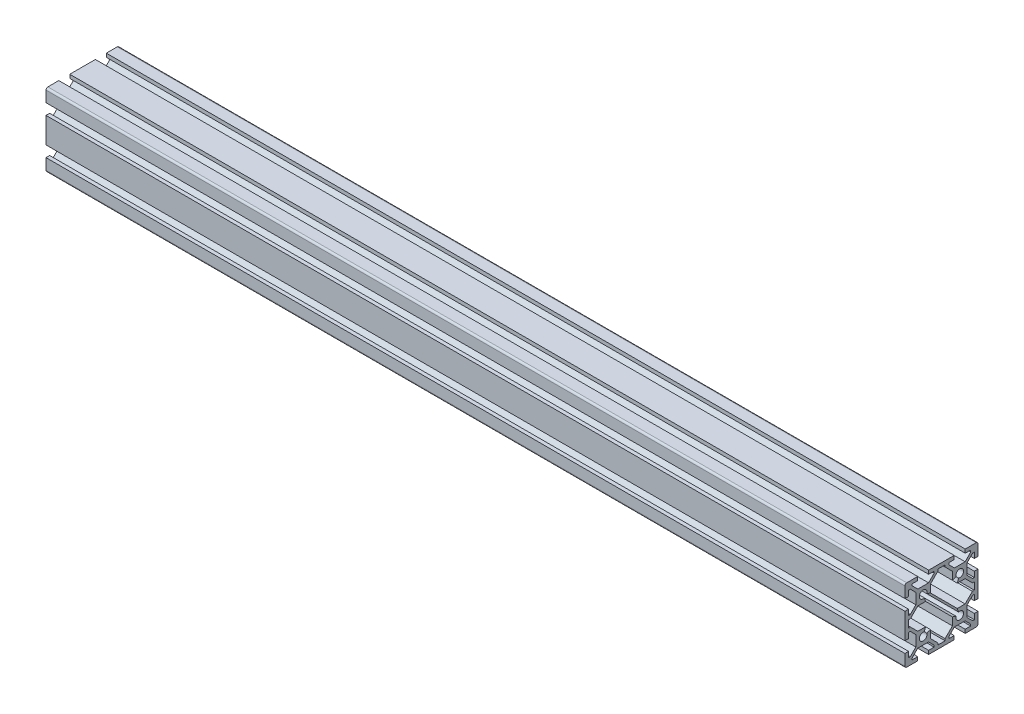
from build123d import *

# Parameters (mm, degrees)
BOSS_EXTRUDE1_DEPTH = 470
SKETCH10_R          = 2.1
BOSS_EXTRUDE4_DEPTH = 15
BOSS_EXTRUDE5_START = -15
SKETCH11_R          = 2.1
BOSS_EXTRUDE5_DEPTH = 15
TAPPED_HOLE3_D      = 4.2
TAPPED_HOLE3_DEPTH  = 15
TAPPED_HOLE4_D      = 4.2


with BuildPart() as part:
    # Sketch1 → Boss-Extrude1 (new body)
    with BuildSketch(Plane(origin=(0, 0, 0), x_dir=(0, 0, -1), z_dir=(1, 0, 0))):
        with BuildLine():
            Line((-20, 19), (-20, 13))
            Line((-20, 13), (-18, 13))
            Line((-18, 13), (-18, 16))
            Line((-18, 16), (-17.060660172, 16))
            Line((-17.060660172, 16), (-14, 12.939339828))
            Line((-14, 12.939339828), (-14, 7.060660172))
            Line((-14, 7.060660172), (-17.060660172, 4))
            Line((-17.060660172, 4), (-18, 4))
            Line((-18, 4), (-18, 7))
            Line((-18, 7), (-20, 7))
            Line((-20, 7), (-20, -7))
            Line((-20, -7), (-18, -7))
            Line((-18, -7), (-18, -4))
            Line((-18, -4), (-17.060660172, -4))
            Line((-17.060660172, -4), (-14, -7.060660172))
            Line((-14, -7.060660172), (-14, -12.939339828))
            Line((-14, -12.939339828), (-17.060660172, -16))
            Line((-17.060660172, -16), (-18, -16))
            Line((-18, -16), (-18, -13))
            Line((-18, -13), (-20, -13))
            Line((-20, -13), (-20, -19))
            ThreePointArc((-20, -19), (-19.707106781, -19.707106781), (-19, -20))
            Line((-19, -20), (-13, -20))
            Line((-13, -20), (-13, -18))
            Line((-13, -18), (-16, -18))
            Line((-16, -18), (-16, -17.060660172))
            Line((-16, -17.060660172), (-12.939339828, -14))
            Line((-12.939339828, -14), (-7.060660172, -14))
            Line((-7.060660172, -14), (-4, -17.060660172))
            Line((-4, -17.060660172), (-4, -18))
            Line((-4, -18), (-7, -18))
            Line((-7, -18), (-7, -20))
            Line((-7, -20), (7, -20))
            Line((7, -20), (7, -18))
            Line((7, -18), (4, -18))
            Line((4, -18), (4, -17.060660172))
            Line((4, -17.060660172), (7.060660172, -14))
            Line((7.060660172, -14), (12.939339828, -14))
            Line((12.939339828, -14), (16, -17.060660172))
            Line((16, -17.060660172), (16, -18))
            Line((16, -18), (13, -18))
            Line((13, -18), (13, -20))
            Line((13, -20), (19, -20))
            ThreePointArc((19, -20), (19.707106781, -19.707106781), (20, -19))
            Line((20, -19), (20, -13))
            Line((20, -13), (18, -13))
            Line((18, -13), (18, -16))
            Line((18, -16), (17.060660172, -16))
            Line((17.060660172, -16), (14, -12.939339828))
            Line((14, -12.939339828), (14, -7.060660172))
            Line((14, -7.060660172), (17.060660172, -4))
            Line((17.060660172, -4), (18, -4))
            Line((18, -4), (18, -7))
            Line((18, -7), (20, -7))
            Line((20, -7), (20, 7))
            Line((20, 7), (18, 7))
            Line((18, 7), (18, 4))
            Line((18, 4), (17.060660172, 4))
            Line((17.060660172, 4), (14, 7.060660172))
            Line((14, 7.060660172), (14, 12.939339828))
            Line((14, 12.939339828), (17.060660172, 16))
            Line((17.060660172, 16), (18, 16))
            Line((18, 16), (18, 13))
            Line((18, 13), (20, 13))
            Line((20, 13), (20, 19))
            ThreePointArc((20, 19), (19.707106781, 19.707106781), (19, 20))
            Line((19, 20), (13, 20))
            Line((13, 20), (13, 18))
            Line((13, 18), (16, 18))
            Line((16, 18), (16, 17.060660172))
            Line((16, 17.060660172), (12.939339828, 14))
            Line((12.939339828, 14), (7.060660172, 14))
            Line((7.060660172, 14), (4, 17.060660172))
            Line((4, 17.060660172), (4, 18))
            Line((4, 18), (7, 18))
            Line((7, 18), (7, 20))
            Line((7, 20), (-7, 20))
            Line((-7, 20), (-7, 18))
            Line((-7, 18), (-4, 18))
            Line((-4, 18), (-4, 17.060660172))
            Line((-4, 17.060660172), (-7.060660172, 14))
            Line((-7.060660172, 14), (-12.939339828, 14))
            Line((-12.939339828, 14), (-16, 17.060660172))
            Line((-16, 17.060660172), (-16, 18))
            Line((-16, 18), (-13, 18))
            Line((-13, 18), (-13, 20))
            Line((-13, 20), (-19, 20))
            ThreePointArc((-19, 20), (-19.707106781, 19.707106781), (-20, 19))
        make_face()
        with BuildLine():
            Line((-16.939339828, 2), (-18, 2))
            Line((-18, 2), (-18, -2))
            Line((-18, -2), (-16.939339828, -2))
            Line((-16.939339828, -2), (-12.939339828, -6))
            Line((-12.939339828, -6), (-8.666662697, -6))
            Line((-8.666662697, -6), (-9.335919912, -8.007765667))
            ThreePointArc((-9.335919912, -8.007765667), (-11.48492424, -11.48492424), (-8.007765667, -9.335919912))
            Line((-8.007765667, -9.335919912), (-6, -8.666662697))
            Line((-6, -8.666662697), (-6, -12.939339828))
            Line((-6, -12.939339828), (-2, -16.939339828))
            Line((-2, -16.939339828), (-2, -18))
            Line((-2, -18), (2, -18))
            Line((2, -18), (2, -16.939339828))
            Line((2, -16.939339828), (6, -12.939339828))
            Line((6, -12.939339828), (6, -8.666662697))
            Line((6, -8.666662697), (8.007765667, -9.335919912))
            ThreePointArc((8.007765667, -9.335919912), (11.48492424, -11.48492424), (9.335919912, -8.007765667))
            Line((9.335919912, -8.007765667), (8.666662697, -6))
            Line((8.666662697, -6), (12.939339828, -6))
            Line((12.939339828, -6), (16.939339828, -2))
            Line((16.939339828, -2), (18, -2))
            Line((18, -2), (18, 2))
            Line((18, 2), (16.939339828, 2))
            Line((16.939339828, 2), (12.939339828, 6))
            Line((12.939339828, 6), (8.666662697, 6))
            Line((8.666662697, 6), (9.335919912, 8.007765667))
            ThreePointArc((9.335919912, 8.007765667), (11.48492424, 11.48492424), (8.007765667, 9.335919912))
            Line((8.007765667, 9.335919912), (6, 8.666662697))
            Line((6, 8.666662697), (6, 12.939339828))
            Line((6, 12.939339828), (2, 16.939339828))
            Line((2, 16.939339828), (2, 18))
            Line((2, 18), (-2, 18))
            Line((-2, 18), (-2, 16.939339828))
            Line((-2, 16.939339828), (-6, 12.939339828))
            Line((-6, 12.939339828), (-6, 8.666662697))
            Line((-6, 8.666662697), (-8.007765667, 9.335919912))
            ThreePointArc((-8.007765667, 9.335919912), (-11.48492424, 11.48492424), (-9.335919912, 8.007765667))
            Line((-9.335919912, 8.007765667), (-8.666662697, 6))
            Line((-8.666662697, 6), (-12.939339828, 6))
            Line((-12.939339828, 6), (-16.939339828, 2))
        make_face(mode=Mode.SUBTRACT)
    extrude(amount=BOSS_EXTRUDE1_DEPTH)

    # Sketch10 → Boss-Extrude4 (add)
    with BuildSketch(Plane(origin=(0, 0, 0), x_dir=(0, 0, -1), z_dir=(1, 0, 0))):
        with Locations((-10, -10)):
            Circle(SKETCH10_R)
        with Locations((10, -10)):
            Circle(SKETCH10_R)
        with Locations((10, 10)):
            Circle(SKETCH10_R)
        with Locations((-10, 10)):
            Circle(SKETCH10_R)
    extrude(amount=BOSS_EXTRUDE4_DEPTH)

    # Sketch11 → Boss-Extrude5 (add)
    with BuildSketch(Plane(origin=(470, 0, 0), x_dir=(0, 0, -1), z_dir=(1, 0, 0)).offset(BOSS_EXTRUDE5_START)):
        with Locations((10, -10)):
            Circle(SKETCH11_R)
        with Locations((-10, -10)):
            Circle(SKETCH11_R)
        with Locations((-10, 10)):
            Circle(SKETCH11_R)
        with Locations((10, 10)):
            Circle(SKETCH11_R)
    extrude(amount=BOSS_EXTRUDE5_DEPTH)

    # Tapped Hole3
    with Locations(Plane(origin=(0, 0, 73.523605606), x_dir=(0, 0, -1), z_dir=(-1, 0, 0))):
        with Locations((63.523605606, -10), (83.523605606, -10), (63.523605606, 10), (83.523605606, 10)):
            Hole(TAPPED_HOLE3_D / 2, depth=TAPPED_HOLE3_DEPTH)

    # Tapped Hole4 (through all)
    with Locations(Plane(origin=(470, 0, -145.629349724), x_dir=(0, 0, 1), z_dir=(1, 0, 0))):
        with Locations((135.629349724, -10), (155.629349724, -10), (135.629349724, 10), (155.629349724, 10)):
            Hole(TAPPED_HOLE4_D / 2)


solid = part.part
